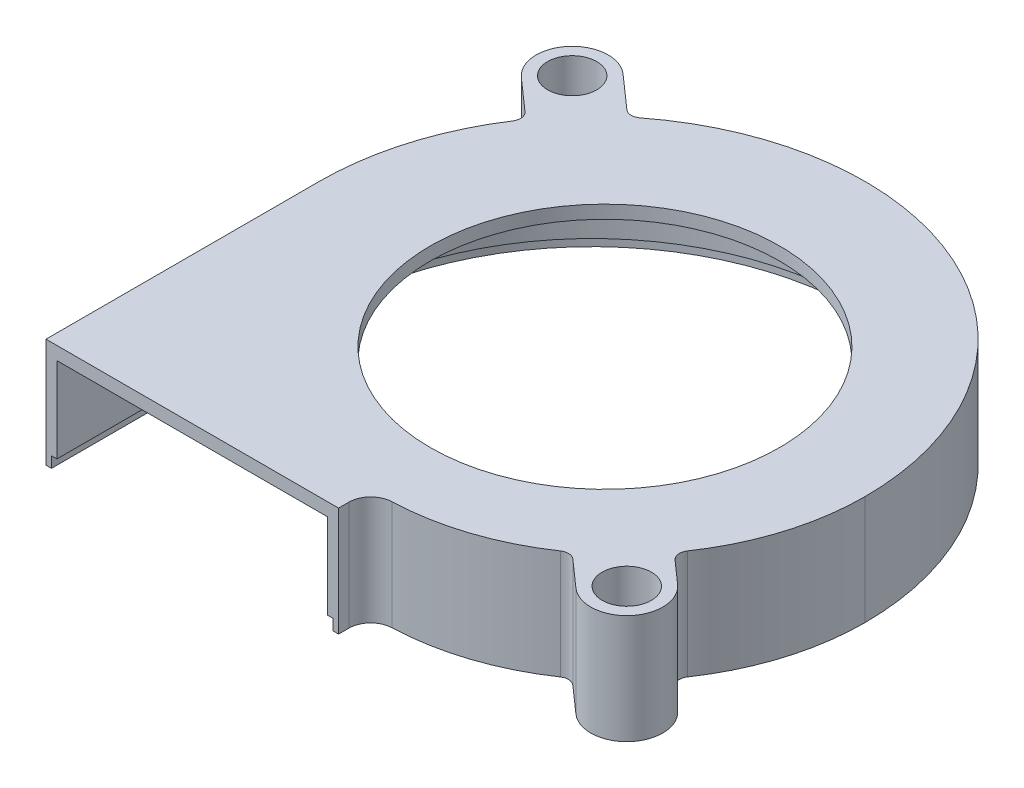
from build123d import *

# Parameters (mm, degrees)
SKETCH_1_R          = 16
SKETCH_1_R_2        = 2.25
EXTRUDE_1_DEPTH     = 10
CUT_EXTRUDE_1_DEPTH = 8.8
CUT_EXTRUDE_8_DEPTH = 1


with BuildPart() as part:
    # Эскиз1 → Бобышка-Вытянуть1 (new body)
    with BuildSketch(Plane(origin=(0, 0, 0), x_dir=(1, 0, 0), z_dir=(0, 1, 0))):
        with BuildLine():
            Line((-26.2, -25), (0.6, -25))
            Line((0.6, -25), (0.6, -24.052407766))
            ThreePointArc((0.6, -24.052407766), (1.160508995, -22.66393175), (2.527865647, -22.05370903))
            ThreePointArc((2.527865647, -22.05370903), (8.609379582, -20.969032322), (14.151976117, -18.241220202))
            ThreePointArc((14.151976117, -18.241220202), (14.777726241, -18.069792078), (15.376980036, -18.318480053))
            Line((15.376980036, -18.318480053), (17.814747272, -20.472785982))
            ThreePointArc((17.814747272, -20.472785982), (22.472785982, -20.185252728), (22.185252728, -15.527214018))
            Line((22.185252728, -15.527214018), (20.143734708, -13.723081814))
            ThreePointArc((20.143734708, -13.723081814), (19.813719174, -13.098302749), (19.979075206, -12.411340949))
            ThreePointArc((19.979075206, -12.411340949), (22.823148445, -6.493089604), (23.8, 0))
            ThreePointArc((23.8, 0), (9.805861096, 22.475890034), (-16.53246264, 19.775101396))
            ThreePointArc((-16.53246264, 19.775101396), (-17.177514672, 19.565457211), (-17.807958535, 19.815623843))
            Line((-17.807958535, 19.815623843), (-20.814747272, 22.472785982))
            ThreePointArc((-20.814747272, 22.472785982), (-25.472785982, 22.185252728), (-25.185252728, 17.527214018))
            Line((-25.185252728, 17.527214018), (-22.311461479, 14.987584542))
            ThreePointArc((-22.311461479, 14.987584542), (-21.982680627, 14.372275298), (-22.136211376, 13.691738288))
            ThreePointArc((-22.136211376, 13.691738288), (-25.166639381, 7.142239829), (-26.2, 0))
            Line((-26.2, 0), (-26.2, -25))
        make_face()
        with Locations(Location((0, 0, 0), (0, 0, 270))):
            Circle(SKETCH_1_R, mode=Mode.SUBTRACT)
        with Locations(Location((-23, 20, 0), (0, 0, 270))):
            Circle(SKETCH_1_R_2, mode=Mode.SUBTRACT)
        with Locations(Location((20, -18, 0), (0, 0, 270))):
            Circle(SKETCH_1_R_2, mode=Mode.SUBTRACT)
    extrude(amount=-EXTRUDE_1_DEPTH)

    # Эскиз2 → Вырез-Вытянуть1 (cut)
    with BuildSketch(Plane(origin=(0, -10, 0), x_dir=(-1, 0, 0), z_dir=(0, -1, 0))):
        with BuildLine():
            Line((0.4, -25), (0.4, -24.052407766))
            ThreePointArc((0.4, -24.052407766), (-0.440763493, -21.969693742), (-2.491798471, -21.054359663))
            ThreePointArc((-2.491798471, -21.054359663), (-8.297732589, -20.018834368), (-13.589169994, -17.414631267))
            ThreePointArc((-13.589169994, -17.414631267), (-16.632858543, -14.893819788), (-19.152217909, -11.84892917))
            ThreePointArc((-19.152217909, -11.84892917), (-21.867498452, -6.198584635), (-22.799999992, 0.0005752))
            ThreePointArc((-22.799999992, 0.0005752), (-9.365885893, 21.577880063), (15.919164541, 18.985249865))
            ThreePointArc((15.919164541, 18.985249865), (18.852153178, 16.289251545), (21.298763477, 13.145221119))
            ThreePointArc((21.298763477, 13.145221119), (24.208055551, 6.857429147), (25.2, 0.000581878))
            Line((25.2, 0.000581878), (25.2, -25))
            Line((25.2, -25), (0.4, -25))
        make_face()
    extrude(amount=-CUT_EXTRUDE_1_DEPTH, mode=Mode.SUBTRACT)

    # Эскиз11 → Вырез-Вытянуть8 (cut)
    with BuildSketch(Plane.XZ.offset(10)):
        with BuildLine():
            Line((-0.4, 24.052407766), (-0.4, 25))
            Line((-0.4, 25), (0.1, 25))
            Line((0.1, 25), (0.1, 24.052407766))
            ThreePointArc((0.1, 24.052407766), (0.800636244, 22.316812746), (2.509832059, 21.554034346))
            ThreePointArc((2.509832059, 21.554034346), (17.255552057, 14.973268455), (23.299999998, -0.000287804))
            ThreePointArc((23.299999998, -0.000287804), (-1.199999175, -24.528816589), (-25.7, -0.000289454))
            Line((-25.7, -0.000289454), (-25.7, 25))
            Line((-25.7, 25), (-25.2, 25))
            Line((-25.2, 25), (-25.2, -0.000581878))
            ThreePointArc((-25.2, -0.000581878), (-1.199996661, -24.028816589), (22.799999992, -0.0005752))
            ThreePointArc((22.799999992, -0.0005752), (16.895779065, 14.626046024), (2.491798471, 21.054359663))
            ThreePointArc((2.491798471, 21.054359663), (0.440763493, 21.969693742), (-0.4, 24.052407766))
        make_face()
    extrude(amount=-CUT_EXTRUDE_8_DEPTH, mode=Mode.SUBTRACT)


solid = part.part
